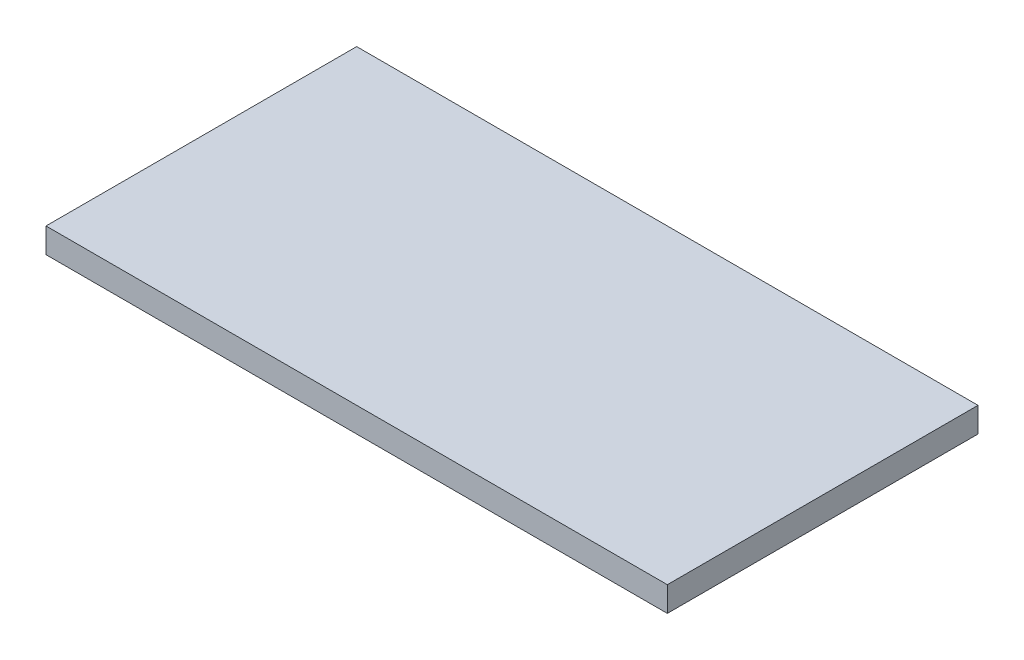
from build123d import *

# Parameters (mm, degrees)
SKETCH2_W           = 100
SKETCH2_H           = 50
BOSS_EXTRUDE3_DEPTH = 4.004841517


with BuildPart() as part:
    # Sketch2 → Boss-Extrude3 (new body)
    with BuildSketch(Plane(origin=(0, 0, 0), x_dir=(1, 0, 0), z_dir=(0, 1, 0))):
        with Locations((3.728813559, -8.220338983)):
            Rectangle(SKETCH2_W, SKETCH2_H)
    extrude(amount=BOSS_EXTRUDE3_DEPTH)


solid = part.part
